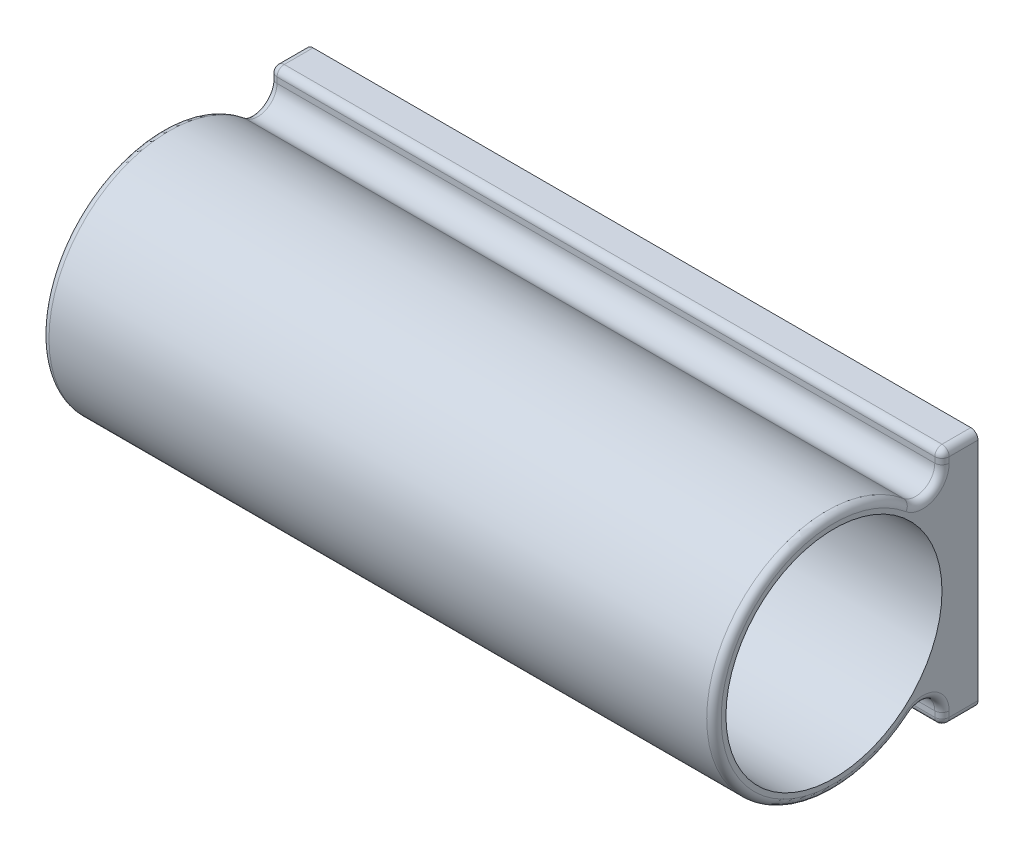
from build123d import *

# Parameters (mm, degrees)
EXTRUDE_1_DEPTH     = 140
FILLET_1_R          = 3
SKETCH_3_R          = 45
CUT_EXTRUDE_1_DEPTH = 275
SKETCH_4_R          = 10
CUT_EXTRUDE_2_DEPTH = 30


with BuildPart() as part:
    # Эскиз1 → Бобышка-Вытянуть1 (new, symmetric)
    with BuildSketch(Plane(origin=(0, 0, 0), x_dir=(0, 0, -1), z_dir=(1, 0, 0))):
        with BuildLine():
            Line((60, -50), (60, 50))
            Line((60, 50), (48, 50))
            ThreePointArc((48, 50), (45.878679656, 49.121320344), (45, 47))
            Line((45, 47), (45, 44.665422868))
            ThreePointArc((45, 44.665422868), (40.403851774, 37.42568578), (31.896551724, 38.504674886))
            ThreePointArc((31.896551724, 38.504674886), (-50, 0), (31.896551724, -38.504674886))
            ThreePointArc((31.896551724, -38.504674886), (40.403851774, -37.42568578), (45, -44.665422868))
            Line((45, -44.665422868), (45, -47))
            ThreePointArc((45, -47), (45.878679656, -49.121320344), (48, -50))
            Line((48, -50), (60, -50))
        make_face()
    extrude(amount=EXTRUDE_1_DEPTH, both=True)

    # Скругление1
    fillet_1_edges = [part.edges().sort_by_distance(p)[0] for p in [
        (-140, 0, 50),
        (-140, 37.42568578, -40.403851774),
        (-140, 45.832711434, -45),
        (-140, 49.121320344, -45.878679656),
        (-140, 50, -54),
        (-140, -50, -54),
        (-140, -49.121320344, -45.878679656),
        (140, 50, -54),
        (140, 49.121320344, -45.878679656),
        (140, 45.832711434, -45),
        (140, 37.42568578, -40.403851774),
        (140, 0, 50),
        (140, -37.42568578, -40.403851774),
        (140, -45.832711434, -45),
        (140, -49.121320344, -45.878679656),
        (140, -50, -54),
        (-140, -45.832711434, -45),
        (-140, -37.42568578, -40.403851774),
    ]]
    fillet(fillet_1_edges, radius=FILLET_1_R)

    # Эскиз2 → Повернуть1 (revolve)
    with BuildSketch(Plane(origin=(0, 0, 0), x_dir=(0, 0, -1), z_dir=(1, 0, 0)), mode=Mode.PRIVATE) as revolve_1_sk:
        with BuildLine():
            Line((60, 0), (60, 10))
            Line((60, 10), (80, 10))
            Line((80, 10), (80, 20))
            ThreePointArc((80, 20), (87.360679775, 11.180339887), (90, 0))
            Line((90, 0), (60, 0))
        make_face()
    revolve(revolve_1_sk.sketch.rotate(Axis((0, 0, 60.403427692), (0, 0, -1)), 90), axis=Axis((0, 0, 60.403427692), (0, 0, -1)))

    # Эскиз3 → Вырез-Вытянуть1 (cut)
    with BuildSketch(Plane(origin=(140, 0, 0), x_dir=(0, 0, -1), z_dir=(1, 0, 0))):
        Circle(SKETCH_3_R)
    extrude(amount=-CUT_EXTRUDE_1_DEPTH, mode=Mode.SUBTRACT)

    # Эскиз4 → Вырез-Вытянуть2 (cut)
    with BuildSketch(Plane(origin=(0, 0, -60), x_dir=(-1, 0, 0), z_dir=(0, 0, -1))):
        with Locations((120, 0)):
            Circle(SKETCH_4_R)
    extrude(amount=-CUT_EXTRUDE_2_DEPTH, mode=Mode.SUBTRACT)


solid = part.part
